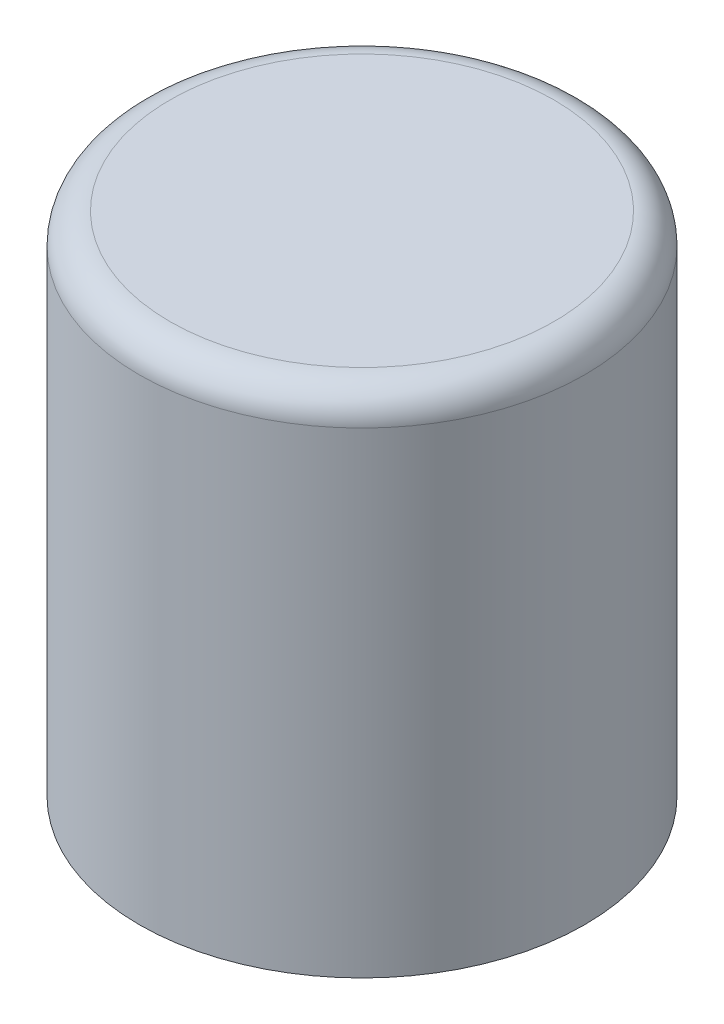
from build123d import *

# Parameters (mm, degrees)
SKETCH1_R           = 7.25
BOSS_EXTRUDE1_DEPTH = 16.5
FILLET1_R           = 1
SKETCH4_R           = 3
BOSS_EXTRUDE2_DEPTH = 1
SKETCH5_R           = 0.295
CUT_EXTRUDE2_DEPTH  = 10


with BuildPart() as part:
    # Sketch1 → Boss-Extrude1 (new body)
    with BuildSketch(Plane(origin=(0, 0, 0), x_dir=(1, 0, 0), z_dir=(0, 1, 0))):
        with Locations(Location((0, 0, 0), (0, 0, 270))):
            Circle(SKETCH1_R)
    extrude(amount=BOSS_EXTRUDE1_DEPTH)

    # Fillet1
    fillet1_edges = [part.edges().sort_by_distance(p)[0] for p in [
        (0, 16.5, -7.25),
    ]]
    fillet(fillet1_edges, radius=FILLET1_R)

    # Sketch4 → Boss-Extrude2 (add)
    with BuildSketch(Plane.XZ):
        with Locations(Location((0, 0, 0), (0, 0, 90))):
            Circle(SKETCH4_R)
    extrude(amount=BOSS_EXTRUDE2_DEPTH)

    # Sketch5 → Cut-Extrude2 (cut)
    with BuildSketch(Plane.XZ.offset(1)):
        with Locations(Location((0, 0, 0), (0, 0, 270))):
            Circle(SKETCH5_R)
    extrude(amount=-CUT_EXTRUDE2_DEPTH, mode=Mode.SUBTRACT)


solid = part.part
